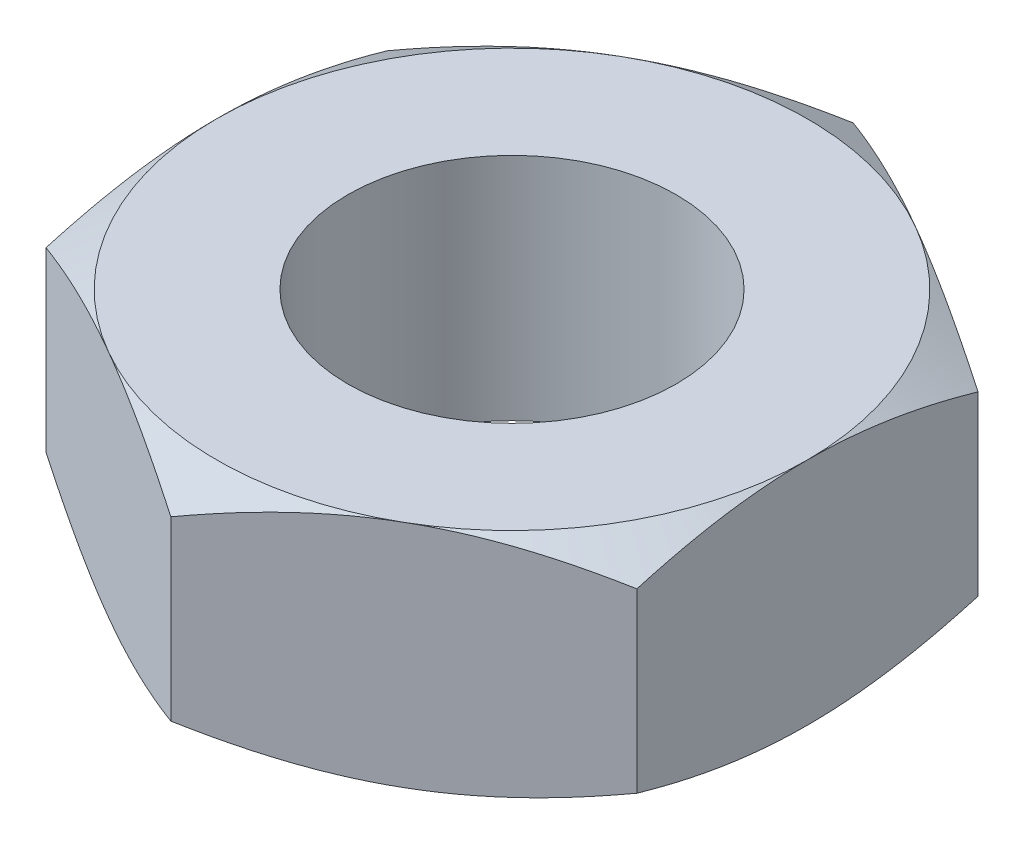
from build123d import *

# Parameters (mm, degrees)
SKETCH1_R           = 1.25
BOSS_EXTRUDE1_DEPTH = 1.75
SKETCH2_OUTSIDE_W   = 14.846
SKETCH2_OUTSIDE_H   = 15.542
SKETCH2_OUTSIDE_R   = 2.25
CUT_EXTRUDE1_DEPTH  = 2
CUT_EXTRUDE1_DRAFT  = -60
SKETCH3_OUTSIDE_W   = 14.846
SKETCH3_OUTSIDE_H   = 15.542
SKETCH3_OUTSIDE_R   = 2.25
CUT_EXTRUDE2_DEPTH  = 2
CUT_EXTRUDE2_DRAFT  = -60


with BuildPart() as part:
    # Sketch1 → Boss-Extrude1 (new body)
    with BuildSketch(Plane(origin=(0, 0, 0), x_dir=(1, 0, 0), z_dir=(0, 1, 0))):
        Polygon((0, -2.598076211), (2.25, -1.299038106), (2.25, 1.299038106), (0, 2.598076211), (-2.25, 1.299038106), (-2.25, -1.299038106), align=None)
        with Locations(Location((0, 0, 0), (0, 0, 270))):
            Circle(SKETCH1_R, mode=Mode.SUBTRACT)
    extrude(amount=BOSS_EXTRUDE1_DEPTH)


with BuildPart() as cut_extrude1_tool:
    # Sketch2 outside → Cut-Extrude1 (with draft: the straight prism first)
    with BuildSketch(Plane(origin=(0, 1.75, 0), x_dir=(1, 0, 0), z_dir=(0, 1, 0))):
        Rectangle(SKETCH2_OUTSIDE_W, SKETCH2_OUTSIDE_H)
        Circle(SKETCH2_OUTSIDE_R, mode=Mode.SUBTRACT)
    extrude(amount=-CUT_EXTRUDE1_DEPTH)
    # Cut-Extrude1: the draft: its side faces are tilted about the plane it starts from
    cut_extrude1_sides = [cut_extrude1_tool.faces().sort_by_distance(p)[0] for p in [
        (0, 0.75, 7.771),
        (7.423, 0.75, 0),
        (0, 0.75, -7.771),
        (-7.423, 0.75, 0),
        (-2.25, 0.75, 0),
    ]]
    draft(cut_extrude1_sides, Plane(origin=(0, 1.75, 0), x_dir=(1, 0, 0), z_dir=(0, 1, 0)), CUT_EXTRUDE1_DRAFT)


with BuildPart() as part_1:
    add(part.part)

    # Cut-Extrude1: cut by cut_extrude1_tool
    add(cut_extrude1_tool.part, mode=Mode.SUBTRACT)


with BuildPart() as cut_extrude2_tool:
    # Sketch3 outside → Cut-Extrude2 (with draft: the straight prism first)
    with BuildSketch(Plane.XZ):
        Rectangle(SKETCH3_OUTSIDE_W, SKETCH3_OUTSIDE_H)
        Circle(SKETCH3_OUTSIDE_R, mode=Mode.SUBTRACT)
    extrude(amount=-CUT_EXTRUDE2_DEPTH)
    # Cut-Extrude2: the draft: its side faces are tilted about the plane it starts from
    cut_extrude2_sides = [cut_extrude2_tool.faces().sort_by_distance(p)[0] for p in [
        (0, 1, -7.771),
        (7.423, 1, 0),
        (0, 1, 7.771),
        (-7.423, 1, 0),
        (-2.25, 1, 0),
    ]]
    draft(cut_extrude2_sides, Plane.XZ, CUT_EXTRUDE2_DRAFT)


with BuildPart() as part_2:
    add(part_1.part)

    # Cut-Extrude2: cut by cut_extrude2_tool
    add(cut_extrude2_tool.part, mode=Mode.SUBTRACT)


solid = part_2.part
